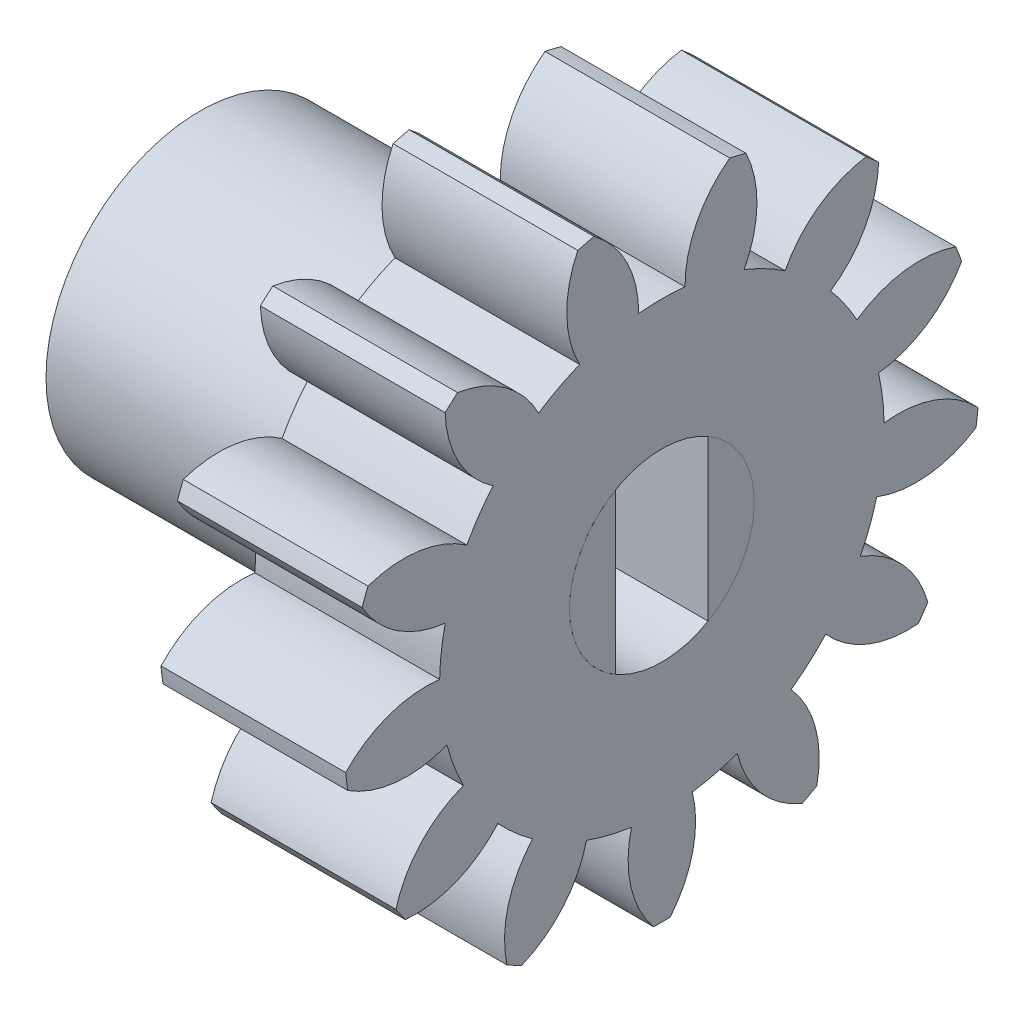
from build123d import *

# Parameters (mm, degrees)
BASPROSKE_W                = 6
BASPROSKE_H                = 10.3125
TOOTHCUT_DEPTH             = 16.77007649
TEETHCUTS_COUNT            = 13
TEETHCUTS_ANGLE            = 332.307692308
HUBNEAONESKE_R             = 5
HUBNEARONE_DEPTH           = 9.0000508
BORSKE_R                   = 3
BORE_DEPTH                 = 15.0000508
RESSALTO_EXTRUS_O1_DEPTH   = 15.0000508
RESSALTO_EXTRUS_O1_2_DEPTH = 15.0000508


with BuildPart() as part:
    # BasProSke → Base-Revolve (revolve)
    with BuildSketch(Plane(origin=(0, 0, 0), x_dir=(1, 0, 0), z_dir=(0, 1, 0)), mode=Mode.PRIVATE) as base_revolve_sk:
        with Locations((3, 5.15625)):
            Rectangle(BASPROSKE_W, BASPROSKE_H)
    revolve(base_revolve_sk.sketch.rotate(Axis((-10, 0, 0), (1, 0, 0)), 180), axis=Axis((-10, 0, 0), (1, 0, 0)))

    # TooCutSke → ToothCut (cut, through all)
    with BuildSketch(Plane(origin=(0, 0, 0), x_dir=(0, 0, -1), z_dir=(1, 0, 0))):
        with BuildLine():
            ThreePointArc((0.752325277, 7.178434491), (0, 7.21775), (-0.752325277, 7.178434491))
            ThreePointArc((-0.752325277, 7.178434491), (-1.139082079, 8.815312292), (-2.231534425, 10.094178051))
            ThreePointArc((-2.231534425, 10.094178051), (0, 10.3379), (2.231534425, 10.094178051))
            ThreePointArc((2.231534425, 10.094178051), (1.139082079, 8.815312292), (0.752325277, 7.178434491))
        make_face()
    toothcut = extrude(amount=TOOTHCUT_DEPTH, mode=Mode.SUBTRACT)

    # TeethCuts: ToothCut ×13 about axis
    teethcuts_axis = Axis((-10, 0, 0), (1, 0, 0))
    for i in range(1, TEETHCUTS_COUNT):
        add(toothcut.rotate(teethcuts_axis, i * TEETHCUTS_ANGLE / (TEETHCUTS_COUNT - 1)), mode=Mode.SUBTRACT)

    # HubNeaOneSke → HubNearOne (add)
    with BuildSketch(Plane.ZY):
        with Locations(Location((0, 0, 0), (0, 0, 180))):
            Circle(HUBNEAONESKE_R)
    extrude(amount=HUBNEARONE_DEPTH)

    # BorSke → Bore (cut, symmetric)
    with BuildSketch(Plane(origin=(0, 0, 0), x_dir=(0, 0, -1), z_dir=(1, 0, 0))):
        with Locations(Location((0, 0, 0), (0, 0, 180))):
            Circle(BORSKE_R)
    extrude(amount=BORE_DEPTH, both=True, mode=Mode.SUBTRACT)


with BuildPart() as body_2:
    # Esboço1 → Ressalto-extrusão1 (new body)
    with BuildSketch(Plane(origin=(6, 0, 0), x_dir=(0, 0, -1), z_dir=(1, 0, 0))):
        with BuildLine():
            Line((-1.5, -2.598076211), (-1.5, 2.598076211))
            ThreePointArc((-1.5, 2.598076211), (-3, 0), (-1.5, -2.598076211))
        make_face()
    extrude(amount=-RESSALTO_EXTRUS_O1_DEPTH)


with BuildPart() as body_3:
    # Esboço1 → Ressalto-extrus_o1 2 (new body)
    with BuildSketch(Plane(origin=(6, 0, 0), x_dir=(0, 0, -1), z_dir=(1, 0, 0))):
        with BuildLine():
            Line((1.5, -2.598076211), (1.5, 2.598076211))
            ThreePointArc((1.5, 2.598076211), (3, 0), (1.5, -2.598076211))
        make_face()
    extrude(amount=-RESSALTO_EXTRUS_O1_2_DEPTH)


solid = Compound([part.part, body_2.part, body_3.part])
